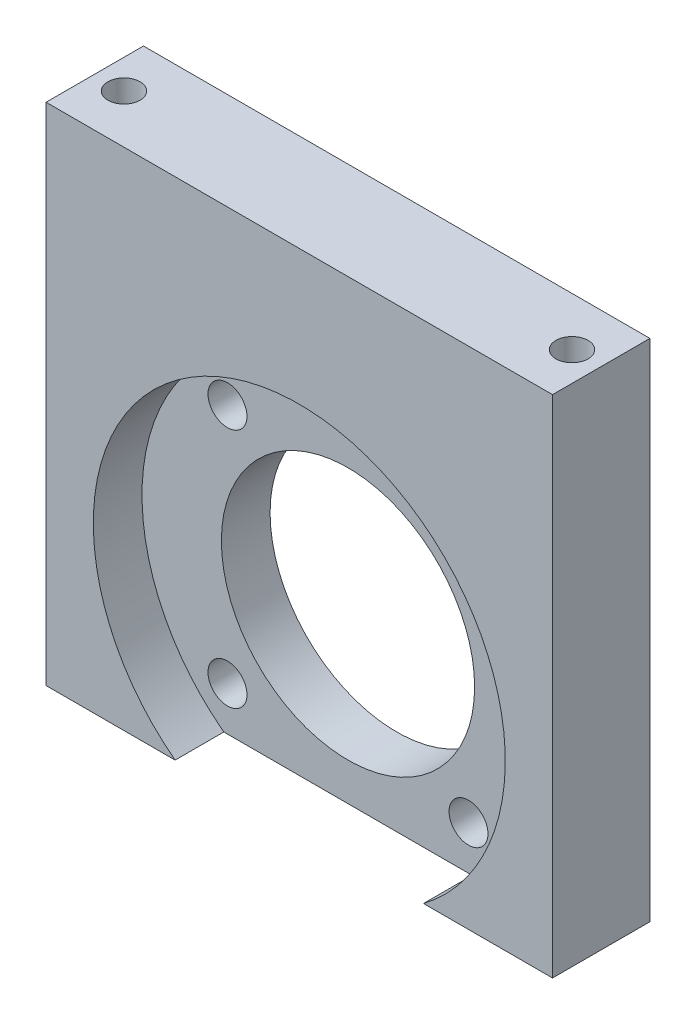
from build123d import *

# Parameters (mm, degrees)
SKETCH_1_W           = 52
SKETCH_1_H           = 20
EXTRUDE_4_DEPTH      = 50
SKETCH_11_R          = 21.15
CUT_EXTRUDE_7_DEPTH  = 13
SKETCH_14_R          = 13
CUT_EXTRUDE_9_DEPTH  = 15
CUT_EXTRUDE_13_DEPTH = 35
MM_6_D               = 3.3
MM_6_DEPTH           = 15
MM_6_TIP             = 0.991420021
SKETCH_62_W          = 52
SKETCH_62_H          = 10
CUT_EXTRUDE_14_DEPTH = 97
SKETCH_63_R          = 21.15
CUT_EXTRUDE_15_DEPTH = 2
SKETCH_54_R          = 2
CUT_EXTRUDE_18_DEPTH = 10
SKETCH_76_W          = 52
SKETCH_76_H          = 10
EXTRUDE_7_DEPTH      = 10
F_1_0MM_1_D          = 3.3
F_1_0MM_1_DEPTH      = 15
F_1_0MM_1_TIP        = 0.991420021


with BuildPart() as part:
    # 草图1 → 凸台-拉伸4 (new body)
    with BuildSketch(Plane(origin=(0, 0, 0), x_dir=(1, 0, 0), z_dir=(0, 1, 0))):
        with Locations((26, 10)):
            Rectangle(SKETCH_1_W, SKETCH_1_H)
    extrude(amount=EXTRUDE_4_DEPTH)

    # 草图11 → 切除-拉伸7 (cut)
    with BuildSketch(Plane.XY):
        with Locations((26, 25)):
            Circle(SKETCH_11_R)
    extrude(amount=-CUT_EXTRUDE_7_DEPTH, mode=Mode.SUBTRACT)

    # 草图14 → 切除-拉伸9 (cut)
    with BuildSketch(Plane.XY.offset(-13)):
        with Locations((26, 25)):
            Circle(SKETCH_14_R)
    extrude(amount=-CUT_EXTRUDE_9_DEPTH, mode=Mode.SUBTRACT)

    # 草图56 → 切除-拉伸13 (cut)
    with BuildSketch(Plane(origin=(0, 0, -20), x_dir=(-1, 0, 0), z_dir=(0, 0, -1))):
        Polygon((-38.374368671, 8.125631329), (-52, 8.125631329), (-52, 0), (0, 0), (0, 8.125631329), align=None)
    extrude(amount=-CUT_EXTRUDE_13_DEPTH, mode=Mode.SUBTRACT)

    # 大小mm 暗销孔6
    with Locations(Plane(origin=(3, 8.125631329, -5), x_dir=(-1, 0, 0), z_dir=(0, -1, 0))):
        with Locations((0, 0), (0, 10), (-46, 0), (-46, 10)):
            Hole(MM_6_D / 2, depth=MM_6_DEPTH)
            with Locations((0, 0, -(MM_6_DEPTH + MM_6_TIP / 2))):  # 118° drill point
                Cone(0, MM_6_D / 2, MM_6_TIP, mode=Mode.SUBTRACT)

    # 草图62 → 切除-拉伸14 (cut)
    with BuildSketch(Plane(origin=(0, 50, 0), x_dir=(1, 0, 0), z_dir=(0, 1, 0))):
        with Locations((26, 5)):
            Rectangle(SKETCH_62_W, SKETCH_62_H)
    extrude(amount=-CUT_EXTRUDE_14_DEPTH, mode=Mode.SUBTRACT)

    # 草图63 → 切除-拉伸15 (cut)
    with BuildSketch(Plane.XY.offset(-13)):
        with Locations((26, 25)):
            Circle(SKETCH_63_R)
    extrude(amount=-CUT_EXTRUDE_15_DEPTH, mode=Mode.SUBTRACT)

    # 草图54 → 切除-拉伸18 (cut)
    with BuildSketch(Plane(origin=(0, 0, -20), x_dir=(-1, 0, 0), z_dir=(0, 0, -1))):
        with Locations((-38.374368671, 37.374368671)):
            Circle(SKETCH_54_R)
        with Locations(Location((-13.625631329, 37.374368671, 0), (0, 0, 180))):
            Circle(SKETCH_54_R)
        with Locations((-13.625631329, 12.625631329)):
            Circle(SKETCH_54_R)
        with Locations(Location((-38.374368671, 12.625631329, 0), (0, 0, 180))):
            Circle(SKETCH_54_R)
    extrude(amount=-CUT_EXTRUDE_18_DEPTH, mode=Mode.SUBTRACT)

    # 草图76 → 凸台-拉伸7 (add)
    with BuildSketch(Plane(origin=(0, 50, 0), x_dir=(1, 0, 0), z_dir=(0, 1, 0))):
        with Locations((26, 15)):
            Rectangle(SKETCH_76_W, SKETCH_76_H)
    extrude(amount=EXTRUDE_7_DEPTH)

    # Ø1.0mm 暗销孔1
    with Locations(Plane(origin=(0, 60, 0), x_dir=(1, 0, 0), z_dir=(0, 1, 0))):
        with Locations((3, 15), (49, 15)):
            Hole(F_1_0MM_1_D / 2, depth=F_1_0MM_1_DEPTH)
            with Locations((0, 0, -(F_1_0MM_1_DEPTH + F_1_0MM_1_TIP / 2))):  # 118° drill point
                Cone(0, F_1_0MM_1_D / 2, F_1_0MM_1_TIP, mode=Mode.SUBTRACT)


solid = part.part
